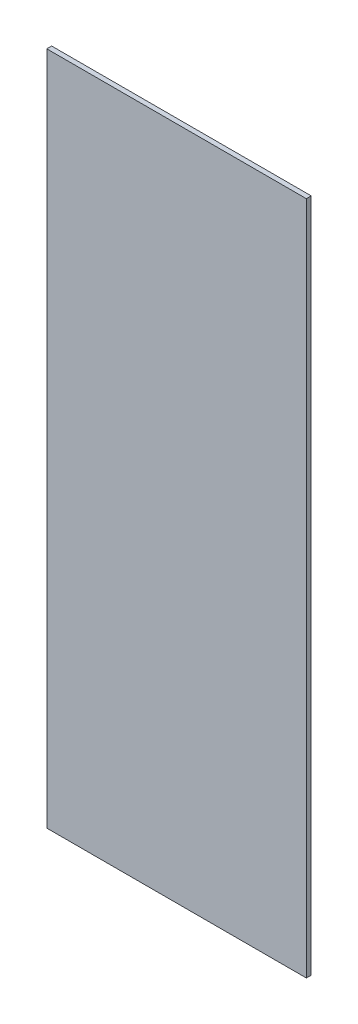
from build123d import *

# Parameters (mm, degrees)
ESQUISSE1_W        = 320
ESQUISSE1_H        = 832
BOSS_EXTRU_1_DEPTH = 6


with BuildPart() as part:
    # Esquisse1 → Boss.-Extru.1 (new body)
    with BuildSketch(Plane.XY):
        Rectangle(ESQUISSE1_W, ESQUISSE1_H)
    extrude(amount=BOSS_EXTRU_1_DEPTH)


solid = part.part
